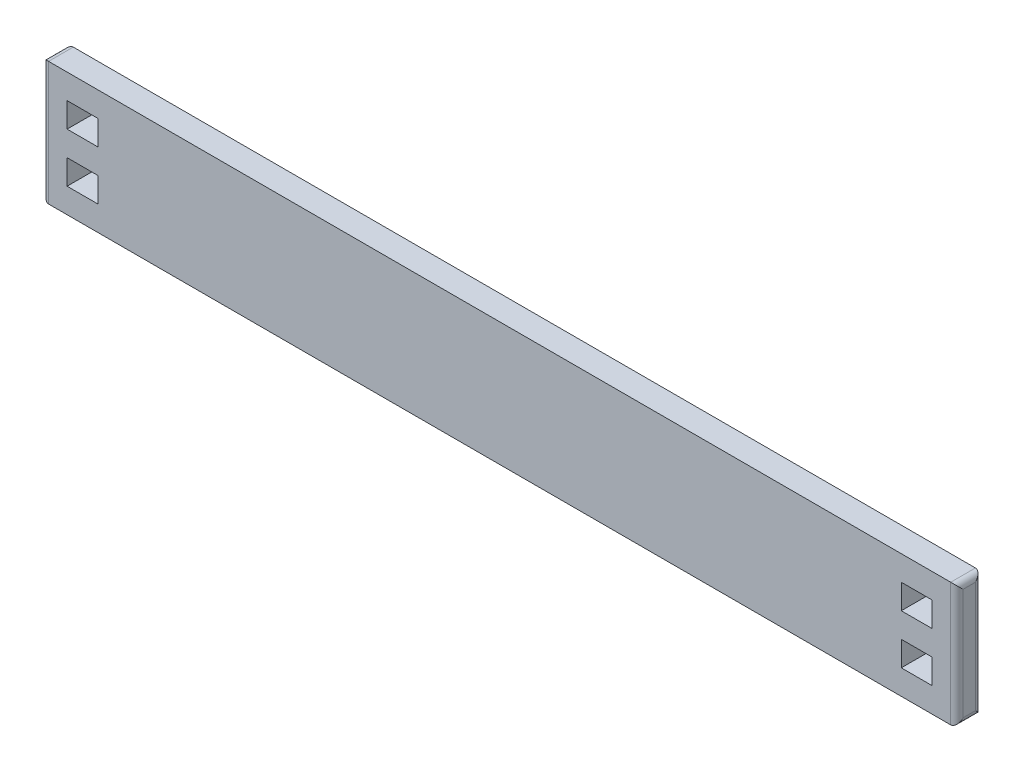
from build123d import *

# Parameters (mm, degrees)
SKETCH_1_W          = 74
SKETCH_1_H          = 20
EXTRUDE_1_DEPTH     = 4
SKETCH_2_W          = 5
SKETCH_2_H          = 4
CUT_EXTRUDE_1_DEPTH = 5
FILLET_1_R          = 1


with BuildPart() as part:
    # 草图1 → 凸台-拉伸1 (new body)
    with BuildSketch(Plane.XY):
        with Locations((-37, 0)):
            Rectangle(SKETCH_1_W, SKETCH_1_H)
        with Locations((37, 0)):
            Rectangle(SKETCH_1_W, SKETCH_1_H)
    extrude(amount=EXTRUDE_1_DEPTH)

    # 草图2 → 切除-拉伸1 (cut)
    with BuildSketch(Plane.XY.offset(4)):
        with Locations((-67.5, -4)):
            Rectangle(SKETCH_2_W, SKETCH_2_H)
        with Locations((-67.5, 4)):
            Rectangle(SKETCH_2_W, SKETCH_2_H)
        with Locations((67.5, 4)):
            Rectangle(SKETCH_2_W, SKETCH_2_H)
        with Locations((67.5, -4)):
            Rectangle(SKETCH_2_W, SKETCH_2_H)
    extrude(amount=-CUT_EXTRUDE_1_DEPTH, mode=Mode.SUBTRACT)

    # 圆角1
    fillet_1_edges = [part.edges().sort_by_distance(p)[0] for p in [
        (-74, 0, 4),
        (74, 0, 4),
        (74, 0, 0),
        (-74, 0, 0),
        (74, 10, 2),
        (74, -10, 2),
        (-74, -10, 2),
        (-74, 10, 2),
    ]]
    fillet(fillet_1_edges, radius=FILLET_1_R)


solid = part.part
